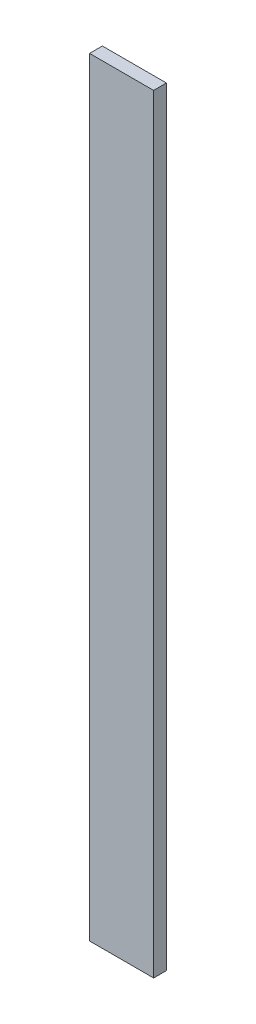
from build123d import *

# Parameters (mm, degrees)
SZKIC1_W                    = 60
SZKIC1_H                    = 720
DODANIE_WYCI_GNI_CIE1_DEPTH = 12


with BuildPart() as part:
    # Szkic1 → Dodanie-wyciągnięcie1 (new body)
    with BuildSketch(Plane.XY):
        with Locations((175, 280)):
            Rectangle(SZKIC1_W, SZKIC1_H)
    extrude(amount=DODANIE_WYCI_GNI_CIE1_DEPTH)


solid = part.part
